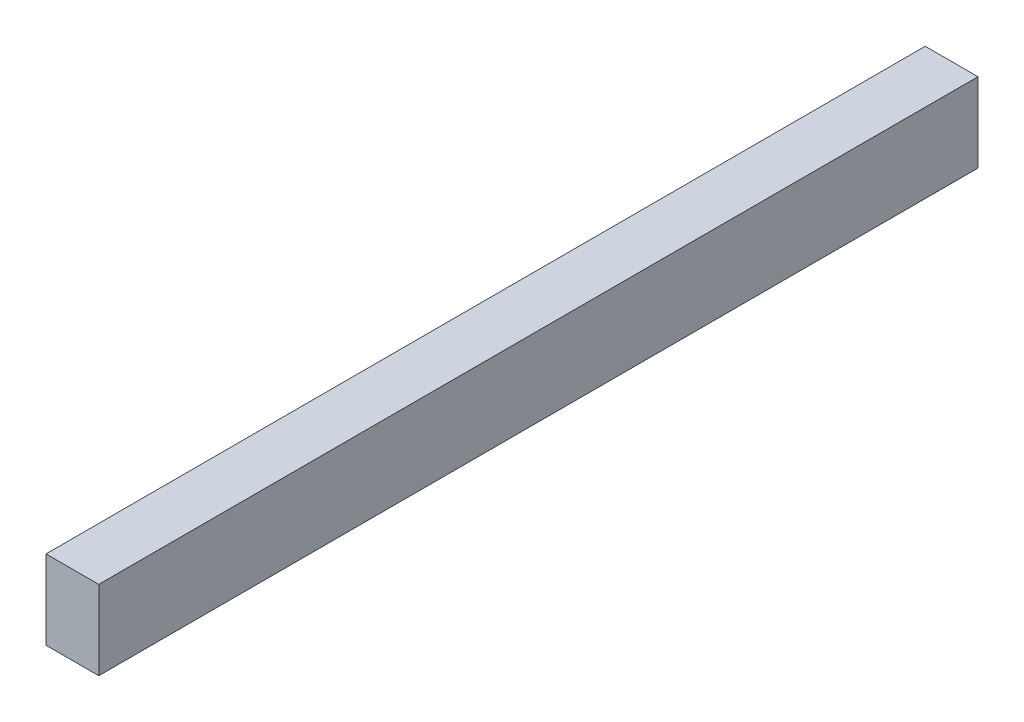
from build123d import *

# Parameters (mm, degrees)
SKETCH1_W           = 500
SKETCH1_H           = 45
BOSS_EXTRUDE1_DEPTH = 30
SKETCH2_W           = 16
SKETCH2_H           = 410
CUT_EXTRUDE1_DEPTH  = 13
SKETCH3_R           = 3.8
CUT_EXTRUDE2_DEPTH  = 95
SKETCH4_R           = 5
CUT_EXTRUDE3_DEPTH  = 12
SKETCH5_W           = 13
SKETCH5_H           = 10
CUT_EXTRUDE4_DEPTH  = 6


with BuildPart() as part:
    # Sketch1 → Boss-Extrude1 (new body)
    with BuildSketch(Plane(origin=(0, 0, 0), x_dir=(0, 0, -1), z_dir=(1, 0, 0))):
        Rectangle(SKETCH1_W, SKETCH1_H)
    extrude(amount=-BOSS_EXTRUDE1_DEPTH)

    # Sketch2 → Cut-Extrude1 (cut)
    with BuildSketch(Plane.XZ.offset(22.5)):
        with Locations((-15, 38)):
            Rectangle(SKETCH2_W, SKETCH2_H)
    extrude(amount=-CUT_EXTRUDE1_DEPTH, mode=Mode.SUBTRACT)

    # Sketch3 → Cut-Extrude2 (cut)
    with BuildSketch(Plane(origin=(0, 0, -250), x_dir=(-1, 0, 0), z_dir=(0, 0, -1))):
        with Locations((15, 0)):
            Circle(SKETCH3_R)
    extrude(amount=-CUT_EXTRUDE2_DEPTH, mode=Mode.SUBTRACT)

    # Sketch4 → Cut-Extrude3 (cut)
    with BuildSketch(Plane.XZ.offset(9.5)):
        with Locations(Location((-15, -162, 0), (0, 0, 270))):
            Circle(SKETCH4_R)
    extrude(amount=-CUT_EXTRUDE3_DEPTH, mode=Mode.SUBTRACT)

    # Sketch5 → Cut-Extrude4 (cut)
    with BuildSketch(Plane.XZ.offset(9.5)):
        with Locations((-15, -162)):
            Rectangle(SKETCH5_W, SKETCH5_H)
    extrude(amount=-CUT_EXTRUDE4_DEPTH, mode=Mode.SUBTRACT)


solid = part.part
